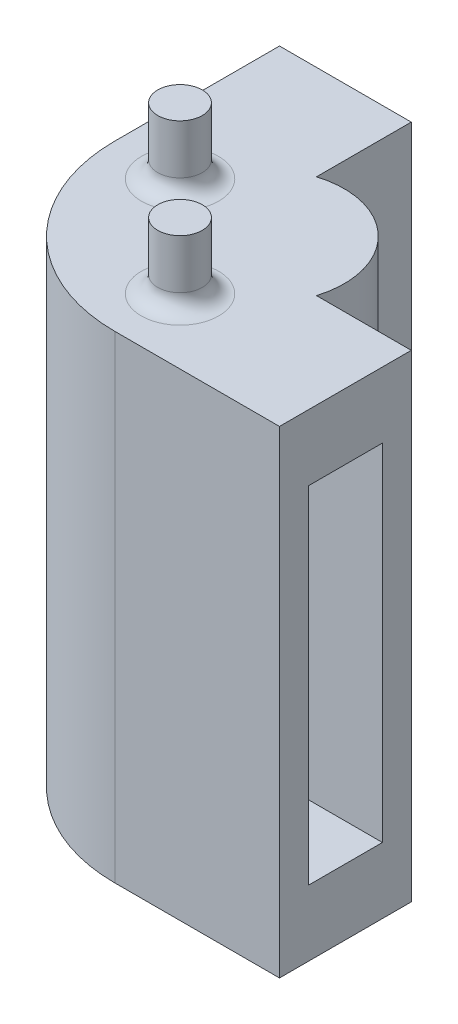
from build123d import *

# Parameters (mm, degrees)
BOSS_EXTRUDE1_DEPTH = 29
SKETCH3_W           = 4.5
SKETCH3_H           = 21
CUT_EXTRUDE1_DEPTH  = 6
SKETCH5_R           = 1.35
BOSS_EXTRUDE2_DEPTH = 4
FILLET1_R           = 1


with BuildPart() as part:
    # Sketch2 → Boss-Extrude1 (new body)
    with BuildSketch(Plane(origin=(0, 0, 0), x_dir=(1, 0, 0), z_dir=(0, 1, 0))):
        with BuildLine():
            Line((0, 10), (0, 20))
            Line((0, 20), (8, 20))
            Line((8, 20), (8, 14.245191882))
            ThreePointArc((8, 14.245191882), (10.672752557, 14.316274399), (13, 13))
            Line((13, 13), (9.464466094, 9.464466094))
            Line((9.464466094, 9.464466094), (2.928932188, 2.928932188))
            ThreePointArc((2.928932188, 2.928932188), (0.761204675, 6.173165676), (0, 10))
        make_face()
    boss_extrude1 = extrude(amount=BOSS_EXTRUDE1_DEPTH)

    # Mirror1: Boss-Extrude1 across plane
    add(boss_extrude1.mirror(Plane(origin=(0, 0, 0), x_dir=(-0.707106781186546, 0, 0.707106781186549), z_dir=(0.707106781186549, 0, 0.707106781186546))))

    # Sketch3 → Cut-Extrude1 (cut)
    with BuildSketch(Plane(origin=(0, 0, -20), x_dir=(-1, 0, 0), z_dir=(0, 0, -1))):
        with Locations((-4, 14.5)):
            Rectangle(SKETCH3_W, SKETCH3_H)
    cut_extrude1 = extrude(amount=-CUT_EXTRUDE1_DEPTH, mode=Mode.SUBTRACT)

    # Mirror2: Cut-Extrude1 across plane
    add(cut_extrude1.mirror(Plane(origin=(0, 0, 0), x_dir=(-0.707106781186546, 0, 0.707106781186549), z_dir=(0.707106781186549, 0, 0.707106781186546))), mode=Mode.SUBTRACT)

    # Sketch5 → Boss-Extrude2 (add)
    with BuildSketch(Plane(origin=(0, 29, 0), x_dir=(1, 0, 0), z_dir=(0, 1, 0))):
        with Locations(Location((9.999139198, 3.962062278, 0), (0, 0, 270))):
            Circle(SKETCH5_R)
        with Locations(Location((3.962062278, 9.999139198, 0), (0, 0, 90))):
            Circle(SKETCH5_R)
    extrude(amount=BOSS_EXTRUDE2_DEPTH)

    # Fillet1
    fillet1_edges = [part.edges().sort_by_distance(p)[0] for p in [
        (9.999139198, 29, -5.312062278),
        (3.962062278, 29, -8.649139198),
    ]]
    fillet(fillet1_edges, radius=FILLET1_R)


solid = part.part
